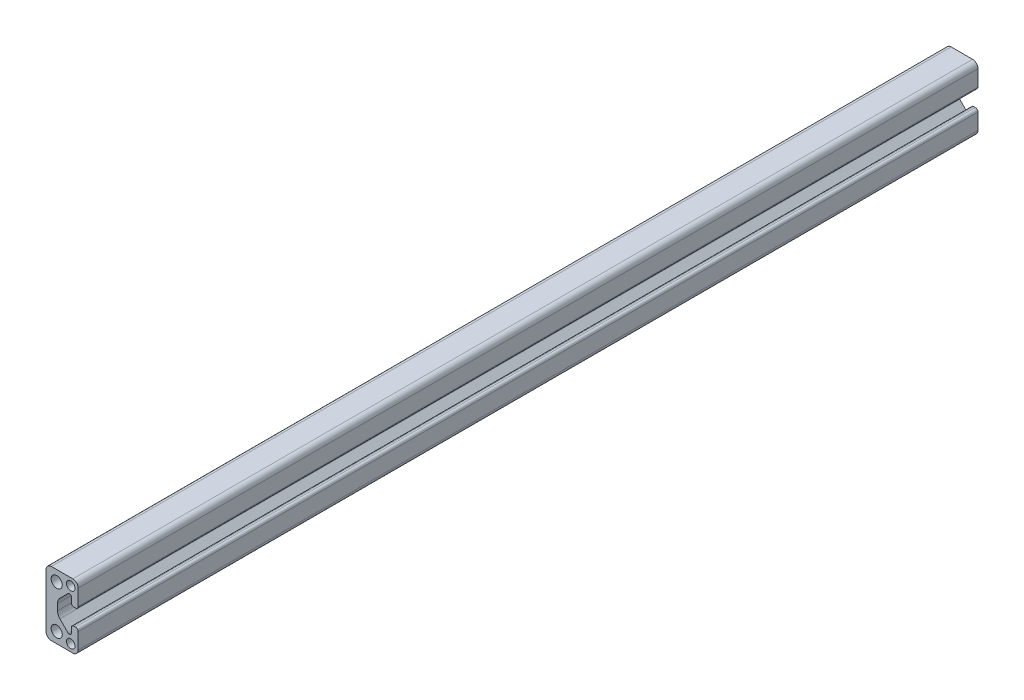
from build123d import *

# Parameters (mm, degrees)
SKETCH3_R               = 2.201333333
SKETCH3_R_2             = 1.693333333
BOSS_EXTRUDE1_DEPTH     = 914.4
CUT_EXTRUDE1_DEPTH      = 1473.2
CUT_EXTRUDE2_DEPTH      = 915.524310439
CUT_EXTRUDE2_DEPTH_BACK = 915.524310439
SKETCH6_R               = 3


with BuildPart() as part:
    # Sketch3 → Boss-Extrude1 (new, symmetric)
    with BuildSketch(Plane.XY):
        with BuildLine():
            Line((-1.778, 0), (-1.778, 1.27))
            ThreePointArc((-1.778, 1.27), (-1.536070654, 2.494011801), (-0.846666667, 3.533942971))
            Line((-0.846666667, 3.533942971), (2.413267273, 6.793876912))
            ThreePointArc((2.413267273, 6.793876912), (2.578074335, 6.903997469), (2.772477518, 6.942666667))
            Line((2.772477518, 6.942666667), (3.048, 6.942666667))
            ThreePointArc((3.048, 6.942666667), (3.467078619, 6.769078619), (3.640666667, 6.35))
            Line((3.640666667, 6.35), (3.640666667, 4.301066667))
            ThreePointArc((3.640666667, 4.301066667), (3.948165494, 3.558698827), (4.690533333, 3.2512))
            Line((4.690533333, 3.2512), (5.300133333, 3.2512))
            ThreePointArc((5.300133333, 3.2512), (6.042501173, 3.558698827), (6.35, 4.301066667))
            Line((6.35, 4.301066667), (6.35, 10.583333333))
            ThreePointArc((6.35, 10.583333333), (5.730042687, 12.080042687), (4.233333333, 12.7))
            Line((4.233333333, 12.7), (-4.233333333, 12.7))
            ThreePointArc((-4.233333333, 12.7), (-5.730042687, 12.080042687), (-6.35, 10.583333333))
            Line((-6.35, 10.583333333), (-6.35, 0))
            Line((-6.35, 0), (-1.778, 0))
        make_face()
        with Locations(Location((-2.116666667, 8.466666667, 0), (0, 0, 180))):
            Circle(SKETCH3_R, mode=Mode.SUBTRACT)
        with Locations(Location((3.429, 9.906, 0), (0, 0, 180))):
            Circle(SKETCH3_R_2, mode=Mode.SUBTRACT)
    extrude(amount=BOSS_EXTRUDE1_DEPTH, both=True)

    # Mirror1: part across plane


with BuildPart() as part_1:
    add(part.part)
    add(part.part.mirror(Plane.ZX))

    # Sketch5 → Cut-Extrude1 (cut)
    with BuildSketch(Plane.XY.offset(914.4)):
        with BuildLine():
            Line((-6.35, 10.583333333), (-6.35, -10.583333333))
            ThreePointArc((-6.35, -10.583333333), (-5.730042687, -12.080042687), (-4.233333333, -12.7))
            Line((-4.233333333, -12.7), (4.233333333, -12.7))
            ThreePointArc((4.233333333, -12.7), (5.730042687, -12.080042687), (6.35, -10.583333333))
            Line((6.35, -10.583333333), (6.35, -4.301066667))
            ThreePointArc((6.35, -4.301066667), (6.042501173, -3.558698827), (5.300133333, -3.2512))
            Line((5.300133333, -3.2512), (4.690533333, -3.2512))
            ThreePointArc((4.690533333, -3.2512), (3.948165494, -3.558698827), (3.640666667, -4.301066667))
            Line((3.640666667, -4.301066667), (3.640666667, -6.35))
            ThreePointArc((3.640666667, -6.35), (3.467078619, -6.769078619), (3.048, -6.942666667))
            Line((3.048, -6.942666667), (2.772477518, -6.942666667))
            ThreePointArc((2.772477518, -6.942666667), (2.578074335, -6.903997469), (2.413267273, -6.793876912))
            Line((2.413267273, -6.793876912), (-0.846666667, -3.533942971))
            ThreePointArc((-0.846666667, -3.533942971), (-1.536070654, -2.494011801), (-1.778, -1.27))
            Line((-1.778, -1.27), (-1.778, 1.27))
            ThreePointArc((-1.778, 1.27), (-1.536070654, 2.494011801), (-0.846666667, 3.533942971))
            Line((-0.846666667, 3.533942971), (2.413267273, 6.793876912))
            ThreePointArc((2.413267273, 6.793876912), (2.578074335, 6.903997469), (2.772477518, 6.942666667))
            Line((2.772477518, 6.942666667), (3.048, 6.942666667))
            ThreePointArc((3.048, 6.942666667), (3.467078619, 6.769078619), (3.640666667, 6.35))
            Line((3.640666667, 6.35), (3.640666667, 4.301066667))
            ThreePointArc((3.640666667, 4.301066667), (3.948165494, 3.558698827), (4.690533333, 3.2512))
            Line((4.690533333, 3.2512), (5.300133333, 3.2512))
            ThreePointArc((5.300133333, 3.2512), (6.042501173, 3.558698827), (6.35, 4.301066667))
            Line((6.35, 4.301066667), (6.35, 10.583333333))
            ThreePointArc((6.35, 10.583333333), (5.730042687, 12.080042687), (4.233333333, 12.7))
            Line((4.233333333, 12.7), (-4.233333333, 12.7))
            ThreePointArc((-4.233333333, 12.7), (-5.730042687, 12.080042687), (-6.35, 10.583333333))
        make_face()
    extrude(amount=-CUT_EXTRUDE1_DEPTH, mode=Mode.SUBTRACT)

    # Sketch6 → Cut-Extrude2 (cut, two sides: drawn at the far end of the back side and taken through both)
    with BuildSketch(Plane(origin=(-1.778, 0, 0), x_dir=(0, 0, -1), z_dir=(1, 0, 0)).offset(-CUT_EXTRUDE2_DEPTH_BACK)):
        with Locations(Location((901.7, 0, 0), (0, 0, 90))):
            Circle(SKETCH6_R)
        with Locations(Location((571.5, 0, 0), (0, 0, 154.954785638))):
            Circle(SKETCH6_R)
    extrude(amount=CUT_EXTRUDE2_DEPTH + CUT_EXTRUDE2_DEPTH_BACK, mode=Mode.SUBTRACT)


solid = part_1.part
